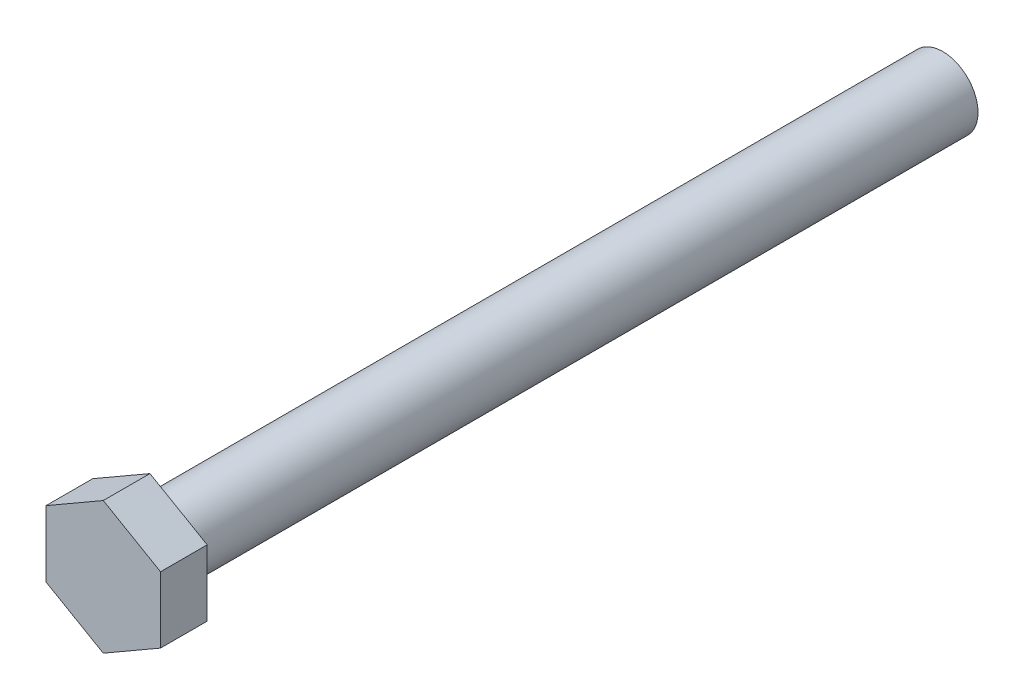
from build123d import *

# Parameters (mm, degrees)
EXTRUDE_357_DEPTH = 5.3
SKETCH_2_R        = 4
EXTRUDE_545_DEPTH = 90


with BuildPart() as part:
    # Эскиз1 → Extrude 357 (new body)
    with BuildSketch(Plane.XY):
        Polygon((0, 7.505553499), (-6.5, 3.75277675), (-6.5, -3.75277675), (0, -7.505553499), (6.5, -3.75277675), (6.5, 3.75277675), align=None)
    extrude(amount=EXTRUDE_357_DEPTH)

    # Эскиз2 → Extrude 545 (add)
    with BuildSketch(Plane(origin=(0, 0, 0), x_dir=(-1, 0, 0), z_dir=(0, 0, -1))):
        with Locations(Location((0, 0, 0), (0, 0, 180))):
            Circle(SKETCH_2_R)
    extrude(amount=EXTRUDE_545_DEPTH)


solid = part.part
